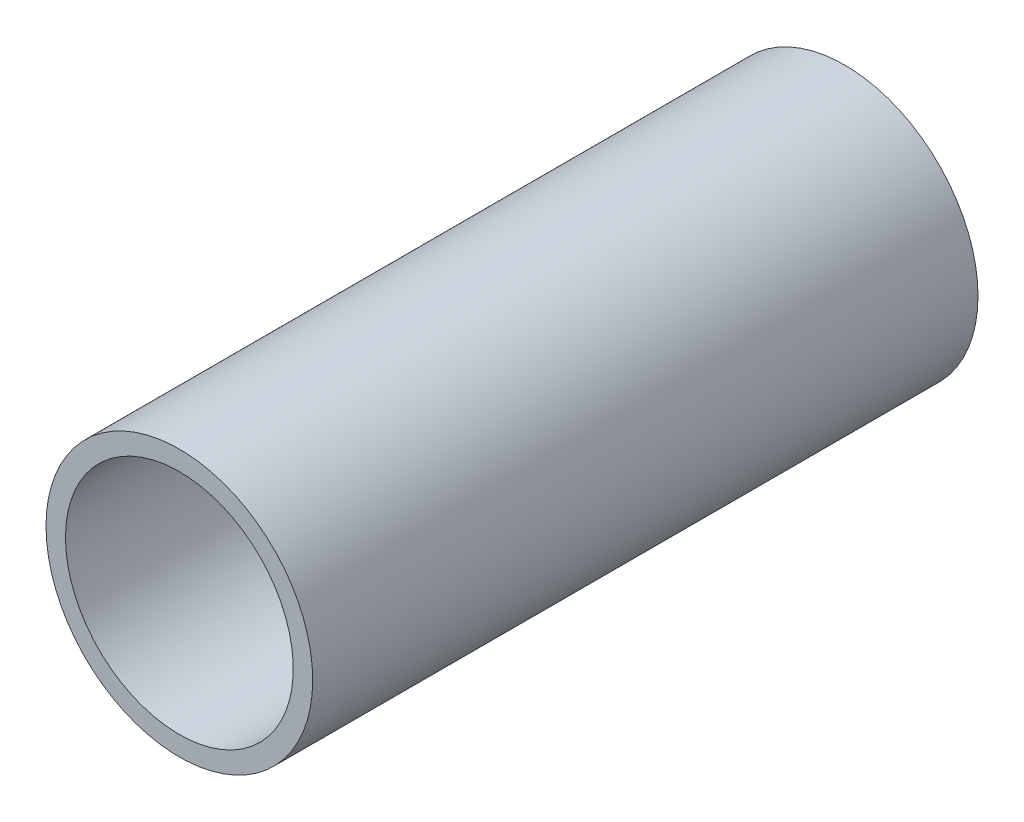
from build123d import *

# Parameters (mm, degrees)
SKETCH1_R           = 44.7
SKETCH1_R_2         = 38.17
BOSS_EXTRUDE1_DEPTH = 223


with BuildPart() as part:
    # Sketch1 → Boss-Extrude1 (new body)
    with BuildSketch(Plane.XY):
        with Locations(Location((0, 0, 0), (0, 0, 180))):
            Circle(SKETCH1_R)
        with Locations(Location((0, 0, 0), (0, 0, 180))):
            Circle(SKETCH1_R_2, mode=Mode.SUBTRACT)
    extrude(amount=BOSS_EXTRUDE1_DEPTH)


solid = part.part
